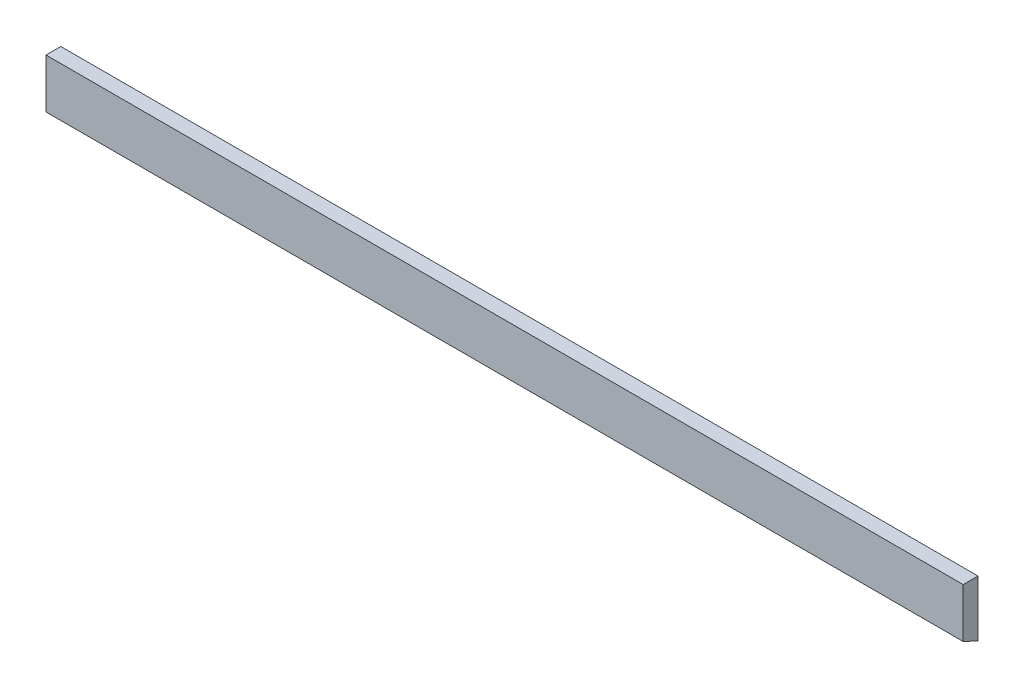
from build123d import *

# Parameters (mm, degrees)
ESQUISSE1_W        = 186
ESQUISSE1_H        = 10
BOSS_EXTRU_1_DEPTH = 3
BOSS_EXTRU_2_DEPTH = 186


with BuildPart() as part:
    # Esquisse1 → Boss.-Extru.1 (new body)
    with BuildSketch(Plane.XY):
        with Locations((-93, 5)):
            Rectangle(ESQUISSE1_W, ESQUISSE1_H)
    extrude(amount=BOSS_EXTRU_1_DEPTH)

    # Esquisse3 → Boss.-Extru.2 (add)
    with BuildSketch(Plane(origin=(0, 0, 0), x_dir=(0, 0, -1), z_dir=(1, 0, 0))):
        Polygon((-3, 0), (0, -1.398922974), (0, 0), align=None)
    extrude(amount=-BOSS_EXTRU_2_DEPTH)


solid = part.part
